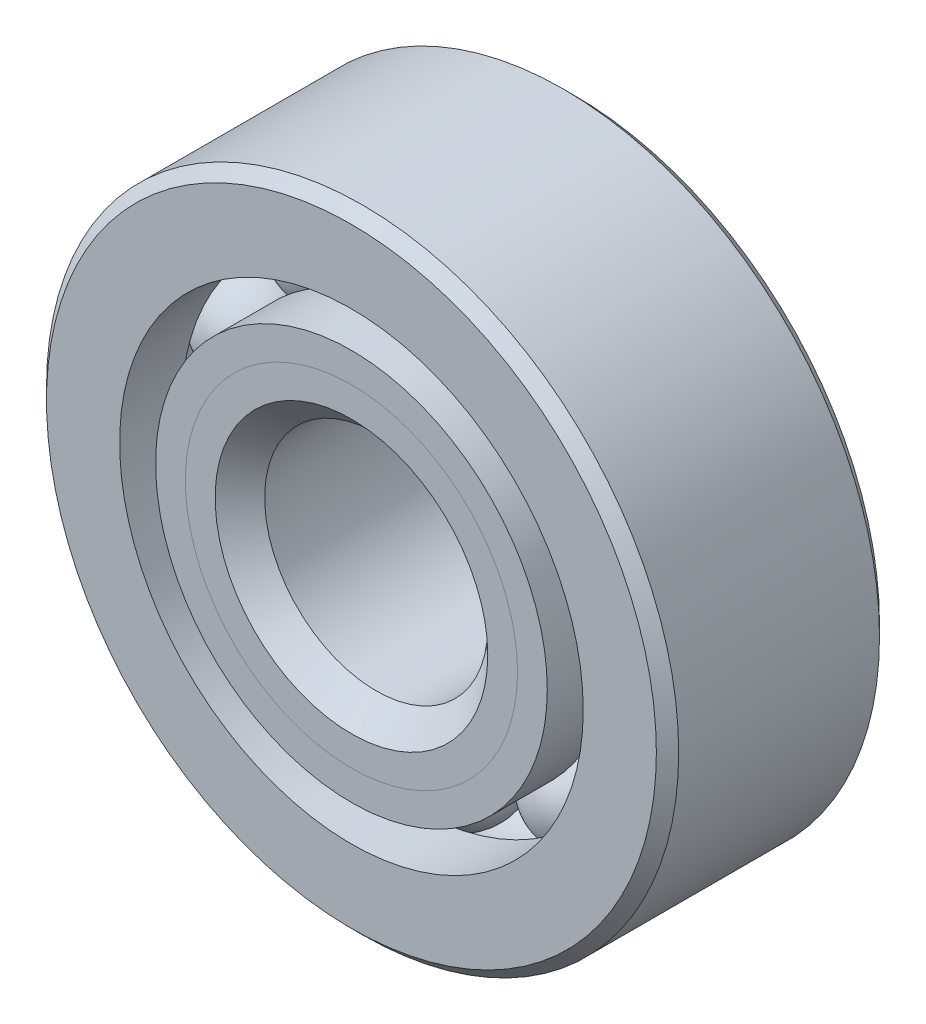
from build123d import *

# Parameters (mm, degrees)
CIRPATTERN1_COUNT = 10


with BuildPart() as part:
    # Sketch1 → Revolve1 (revolve)
    with BuildSketch(Plane(origin=(0, 0, 0), x_dir=(0, 0, -1), z_dir=(1, 0, 0))):
        with BuildLine():
            Line((2.7, 8.5), (-2.7, 8.5))
            Line((-2.7, 8.5), (-3, 8.2))
            Line((-3, 8.2), (-3, 6.233516484))
            Line((-3, 6.233516484), (-1.333333333, 6.233516484))
            ThreePointArc((-1.333333333, 6.233516484), (0, 7.168296855), (1.333333333, 6.233516484))
            Line((1.333333333, 6.233516484), (3, 6.233516484))
            Line((3, 6.233516484), (3, 8.2))
            Line((3, 8.2), (2.7, 8.5))
        make_face()
    revolve(axis=Axis((0, 0, 3), (0, 0, -1)))


with BuildPart() as body_2:
    # Sketch2 → Revolve2 (revolve)
    with BuildSketch(Plane(origin=(0, 0, 0), x_dir=(0, 0, -1), z_dir=(1, 0, 0))):
        with BuildLine():
            Line((-3, 5.266483516), (-1.333333333, 5.266483516))
            ThreePointArc((-1.333333333, 5.266483516), (-0.814185501, 4.588678366), (0, 4.331703145))
            Line((0, 4.331703145), (0, 3.665851573))
            Line((0, 3.665851573), (-2.199684028, 3.665851573))
            Line((-2.199684028, 3.665851573), (-3, 4.466167545))
            Line((-3, 4.466167545), (-3, 5.266483516))
        make_face()
    revolve(axis=Axis((0, 0, 3), (0, 0, -1)))


with BuildPart() as body_3:
    # Sketch3 → Revolve3 (revolve)
    with BuildSketch(Plane(origin=(0, 0, 0), x_dir=(0, 0, -1), z_dir=(1, 0, 0))):
        with BuildLine():
            Line((-3, 4.466167545), (-2.199684028, 3.665851573))
            Line((-2.199684028, 3.665851573), (0, 3.665851573))
            Line((0, 3.665851573), (0, 4.331703145))
            ThreePointArc((0, 4.331703145), (0.814185501, 4.588678366), (1.333333333, 5.266483516))
            Line((1.333333333, 5.266483516), (3, 5.266483516))
            Line((3, 5.266483516), (3, 3.3))
            Line((3, 3.3), (2.7, 3))
            Line((2.7, 3), (-2.334148427, 3))
            Line((-2.334148427, 3), (-3, 3.665851573))
            Line((-3, 3.665851573), (-3, 4.466167545))
        make_face()
    revolve(axis=Axis((0, 0, 3), (0, 0, -1)))


with BuildPart() as body_4:
    # Sketch4 → Revolve4 (revolve)
    with BuildSketch(Plane(origin=(0, 0, 0), x_dir=(0, 0, -1), z_dir=(1, 0, 0))):
        with BuildLine():
            Line((-1.418296855, 5.75), (1.418296855, 5.75))
            ThreePointArc((1.418296855, 5.75), (0, 7.168296855), (-1.418296855, 5.75))
        make_face()
    revolve(axis=Axis((0, 5.75, 1.418296855), (0, 0, -1)))


with BuildPart() as cirpattern1_1:
    # CirPattern1: pattern copy
    add(body_4.part.rotate(Axis((0, 0, -3), (0, 0, 1)), 1 * 360 / CIRPATTERN1_COUNT))


with BuildPart() as cirpattern1_2:
    # CirPattern1: pattern copy
    add(body_4.part.rotate(Axis((0, 0, -3), (0, 0, 1)), 2 * 360 / CIRPATTERN1_COUNT))


with BuildPart() as cirpattern1_3:
    # CirPattern1: pattern copy
    add(body_4.part.rotate(Axis((0, 0, -3), (0, 0, 1)), 3 * 360 / CIRPATTERN1_COUNT))


with BuildPart() as cirpattern1_4:
    # CirPattern1: pattern copy
    add(body_4.part.rotate(Axis((0, 0, -3), (0, 0, 1)), 4 * 360 / CIRPATTERN1_COUNT))


with BuildPart() as cirpattern1_5:
    # CirPattern1: pattern copy
    add(body_4.part.rotate(Axis((0, 0, -3), (0, 0, 1)), 5 * 360 / CIRPATTERN1_COUNT))


with BuildPart() as cirpattern1_6:
    # CirPattern1: pattern copy
    add(body_4.part.rotate(Axis((0, 0, -3), (0, 0, 1)), 6 * 360 / CIRPATTERN1_COUNT))


with BuildPart() as cirpattern1_7:
    # CirPattern1: pattern copy
    add(body_4.part.rotate(Axis((0, 0, -3), (0, 0, 1)), 7 * 360 / CIRPATTERN1_COUNT))


with BuildPart() as cirpattern1_8:
    # CirPattern1: pattern copy
    add(body_4.part.rotate(Axis((0, 0, -3), (0, 0, 1)), 8 * 360 / CIRPATTERN1_COUNT))


with BuildPart() as cirpattern1_9:
    # CirPattern1: pattern copy
    add(body_4.part.rotate(Axis((0, 0, -3), (0, 0, 1)), 9 * 360 / CIRPATTERN1_COUNT))


solid = Compound([part.part, body_2.part, body_3.part, body_4.part, cirpattern1_1.part, cirpattern1_2.part, cirpattern1_3.part, cirpattern1_4.part, cirpattern1_5.part, cirpattern1_6.part, cirpattern1_7.part, cirpattern1_8.part, cirpattern1_9.part])
